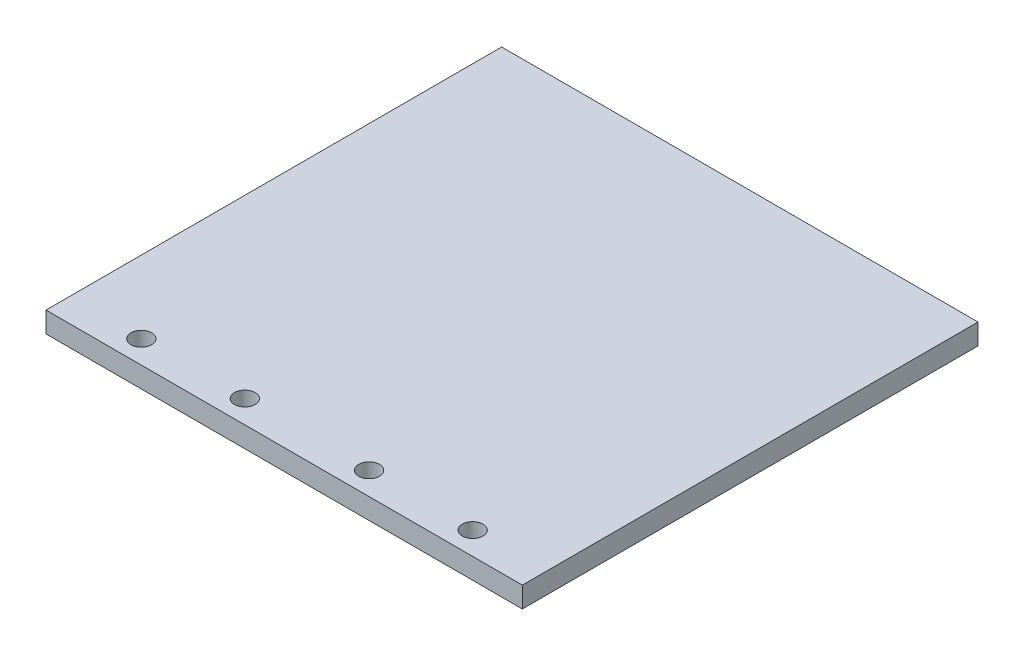
from build123d import *

# Parameters (mm, degrees)
SKETCH2_W           = 115
SKETCH2_H           = 110
BOSS_EXTRUDE1_DEPTH = 5
CUT_EXTRUDE1_REACH  = 81.726
SKETCH3_R           = 2.5


with BuildPart() as part:
    # Sketch2 → Boss-Extrude1 (new body)
    with BuildSketch(Plane(origin=(0, 0, 0), x_dir=(1, 0, 0), z_dir=(0, 1, 0))):
        Rectangle(SKETCH2_W, SKETCH2_H)
    extrude(amount=BOSS_EXTRUDE1_DEPTH)

    # Sketch3 → Cut-Extrude1 (cut, up to next)
    with BuildSketch(Plane.XZ, mode=Mode.PRIVATE) as cut_extrude1_sk1:
        with Locations(Location((-40, 49.5, 0), (0, 0, 270))):
            Circle(SKETCH3_R)
    cut_extrude1_tool1 = extrude(cut_extrude1_sk1.sketch, amount=-CUT_EXTRUDE1_REACH, mode=Mode.PRIVATE) & part.part
    # Sketch3 → Cut-Extrude1 (cut, up to next)
    with BuildSketch(Plane.XZ, mode=Mode.PRIVATE) as cut_extrude1_sk2:
        with Locations(Location((-15, 49.5, 0), (0, 0, 270))):
            Circle(SKETCH3_R)
    cut_extrude1_tool2 = extrude(cut_extrude1_sk2.sketch, amount=-CUT_EXTRUDE1_REACH, mode=Mode.PRIVATE) & part.part
    # Sketch3 → Cut-Extrude1 (cut, up to next)
    with BuildSketch(Plane.XZ, mode=Mode.PRIVATE) as cut_extrude1_sk3:
        with Locations(Location((40, 49.5, 0), (0, 0, 90))):
            Circle(SKETCH3_R)
    cut_extrude1_tool3 = extrude(cut_extrude1_sk3.sketch, amount=-CUT_EXTRUDE1_REACH, mode=Mode.PRIVATE) & part.part
    # Sketch3 → Cut-Extrude1 (cut, up to next)
    with BuildSketch(Plane.XZ, mode=Mode.PRIVATE) as cut_extrude1_sk4:
        with Locations(Location((15, 49.5, 0), (0, 0, 90))):
            Circle(SKETCH3_R)
    cut_extrude1_tool4 = extrude(cut_extrude1_sk4.sketch, amount=-CUT_EXTRUDE1_REACH, mode=Mode.PRIVATE) & part.part
    add(cut_extrude1_tool1.solids().sort_by_distance((-40, 0, 49.5))[0], mode=Mode.SUBTRACT)
    add(cut_extrude1_tool2.solids().sort_by_distance((-15, 0, 49.5))[0], mode=Mode.SUBTRACT)
    add(cut_extrude1_tool3.solids().sort_by_distance((40, 0, 49.5))[0], mode=Mode.SUBTRACT)
    add(cut_extrude1_tool4.solids().sort_by_distance((15, 0, 49.5))[0], mode=Mode.SUBTRACT)


solid = part.part
